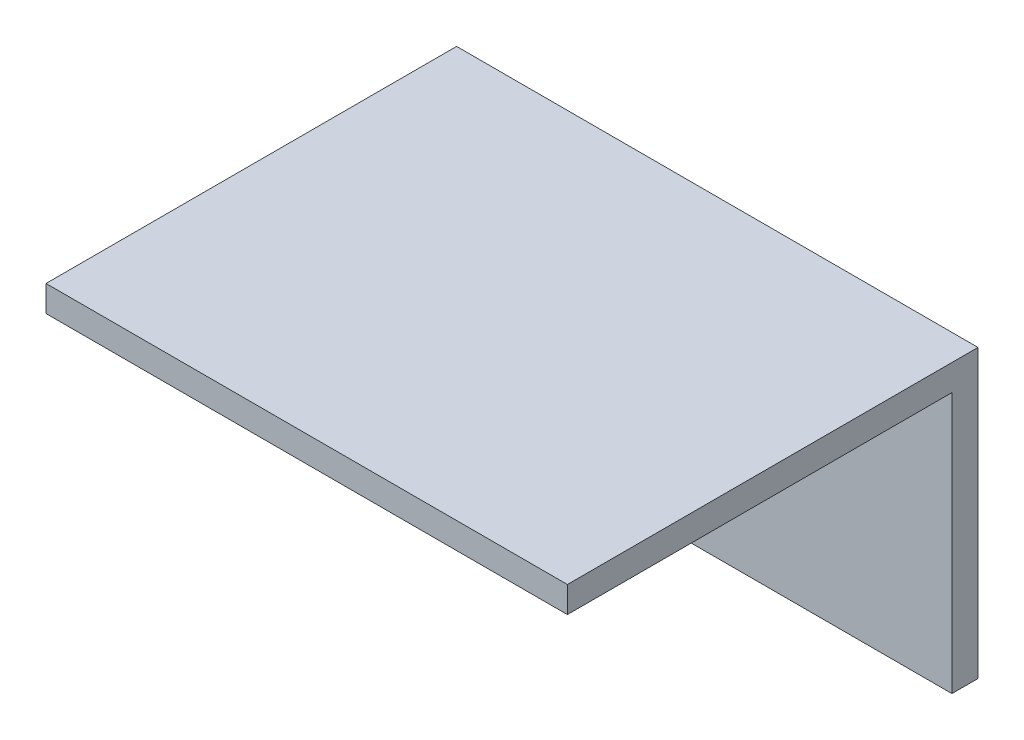
from build123d import *

# Parameters (mm, degrees)
SKETCH1_W           = 40
SKETCH1_H           = 29.5
BOSS_EXTRUDE1_DEPTH = 2
SKETCH2_W           = 40
SKETCH2_H           = 2
BOSS_EXTRUDE2_DEPTH = 22


with BuildPart() as part:
    # Sketch1 → Boss-Extrude1 (new body)
    with BuildSketch(Plane(origin=(0, 0, 0), x_dir=(1, 0, 0), z_dir=(0, 1, 0))):
        with Locations((35.625880705, 19.52457466)):
            Rectangle(SKETCH1_W, SKETCH1_H)
    extrude(amount=BOSS_EXTRUDE1_DEPTH)

    # Sketch2 → Boss-Extrude2 (add)
    with BuildSketch(Plane(origin=(0, 2, 0), x_dir=(1, 0, 0), z_dir=(0, 1, 0))):
        with Locations((35.625880705, 35.27457466)):
            Rectangle(SKETCH2_W, SKETCH2_H)
    extrude(amount=-BOSS_EXTRUDE2_DEPTH)


solid = part.part
